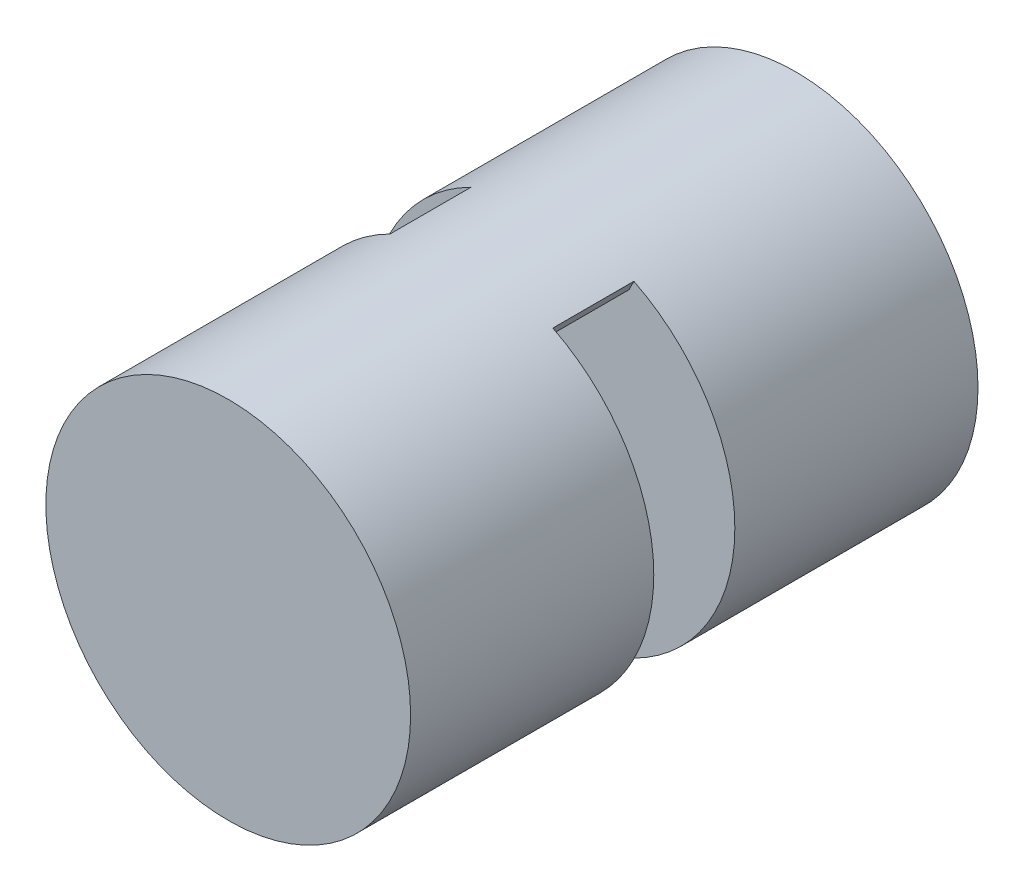
from build123d import *

# Parameters (mm, degrees)
SKETCH_1_R      = 22.5
EXTRUDE_1_DEPTH = 30
EXTRUDE_2_DEPTH = 10
SKETCH_4_R      = 22.5
EXTRUDE_3_DEPTH = 30


with BuildPart() as part:
    # 草图1 → 凸台-拉伸1 (new body)
    with BuildSketch(Plane.XY):
        Circle(SKETCH_1_R)
    extrude(amount=EXTRUDE_1_DEPTH)

    # 草图3 → 凸台-拉伸2 (add)
    with BuildSketch(Plane.XY.offset(30)):
        with BuildLine():
            Line((-10.048538424, 20.13148965), (-9.44725249, 18.926858585))
            ThreePointArc((-9.44725249, 18.926858585), (0, 21.153641661), (9.44725249, 18.926858585))
            Line((9.44725249, 18.926858585), (10.048538424, 20.13148965))
            ThreePointArc((10.048538424, 20.13148965), (0, 22.5), (-10.048538424, 20.13148965))
        make_face()
        with BuildLine():
            Line((-10.048538424, -20.13148965), (-9.44725249, -18.926858585))
            ThreePointArc((-9.44725249, -18.926858585), (0, -21.153641661), (9.44725249, -18.926858585))
            Line((9.44725249, -18.926858585), (10.048538424, -20.13148965))
            ThreePointArc((10.048538424, -20.13148965), (0, -22.5), (-10.048538424, -20.13148965))
        make_face()
    extrude(amount=EXTRUDE_2_DEPTH)

    # 草图4 → 凸台-拉伸3 (add)
    with BuildSketch(Plane.XY.offset(40)):
        Circle(SKETCH_4_R)
    extrude(amount=EXTRUDE_3_DEPTH)


solid = part.part
